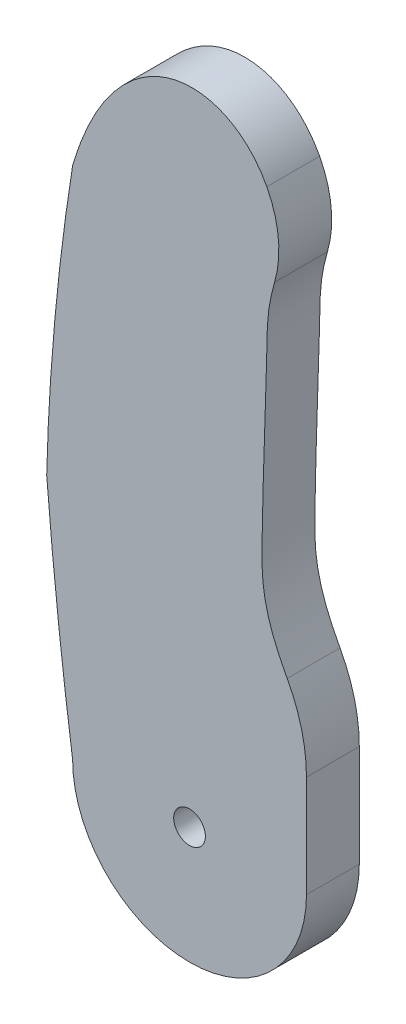
from build123d import *

# Parameters (mm, degrees)
BOSS_EXTRUDE1_DEPTH = 5
SKETCH2_R           = 1.5
CUT_EXTRUDE1_DEPTH  = 15


with BuildPart() as part:
    # Sketch1 → Boss-Extrude1 (new body)
    with BuildSketch(Plane.XY):
        with BuildLine():
            Line((-22.025473837, -12.460288432), (-22.025473837, -22.099692602))
            ThreePointArc((-22.025473837, -22.099692602), (-33.089336525, -33.163555291), (-44.153199213, -22.099692602))
            add(Edge.make_bspline(
                [(-46.60586196, 0), (-45.711257539, -11.089055713), (-44.153199213, -22.099692602)],
                knots=[0, 0, 0, 1, 1, 1], degree=2))
            add(Edge.make_bspline(
                [(-46.60586196, 0), (-46.258692623, 13.374484171), (-44.153199213, 26.582155094)],
                knots=[0, 0, 0, 1, 1, 1], degree=2))
            add(Edge.make_bspline(
                [(-44.153199213, 26.582155094), (-39.900483867, 41.183407978), (-29.408706967, 40.976444126), (-25.777388315, 34.042216579)],
                knots=[0, 0, 0, 0, 0.860338307, 0.860338307, 0.860338307, 0.860338307], degree=3))
            ThreePointArc((-25.777388315, 34.042216579), (-24.684371632, 30.383671766), (-25.042291473, 26.582155094))
            add(Edge.make_bspline(
                [(-25.042291473, 26.582155094), (-25.760015873, 24.141164965), (-25.719709218, 19.504814476), (-26.307467845, 6.668994266), (-26.250257145, -0.88224048), (-23.851756529, -5.287201768)],
                knots=[0.083338388, 0.083338388, 0.083338388, 0.083338388, 0.311519057, 0.73939734, 0.959193523, 0.959193523, 0.959193523, 0.959193523], degree=3))
            ThreePointArc((-23.851756529, -5.287201768), (-22.489212976, -8.759326369), (-22.025473837, -12.460288432))
        make_face()
    extrude(amount=BOSS_EXTRUDE1_DEPTH)

    # Sketch2 → Cut-Extrude1 (cut)
    with BuildSketch(Plane.XY.offset(5)):
        with Locations((-33.089336525, -22.099692602)):
            Circle(SKETCH2_R)
    extrude(amount=-CUT_EXTRUDE1_DEPTH, mode=Mode.SUBTRACT)


solid = part.part
